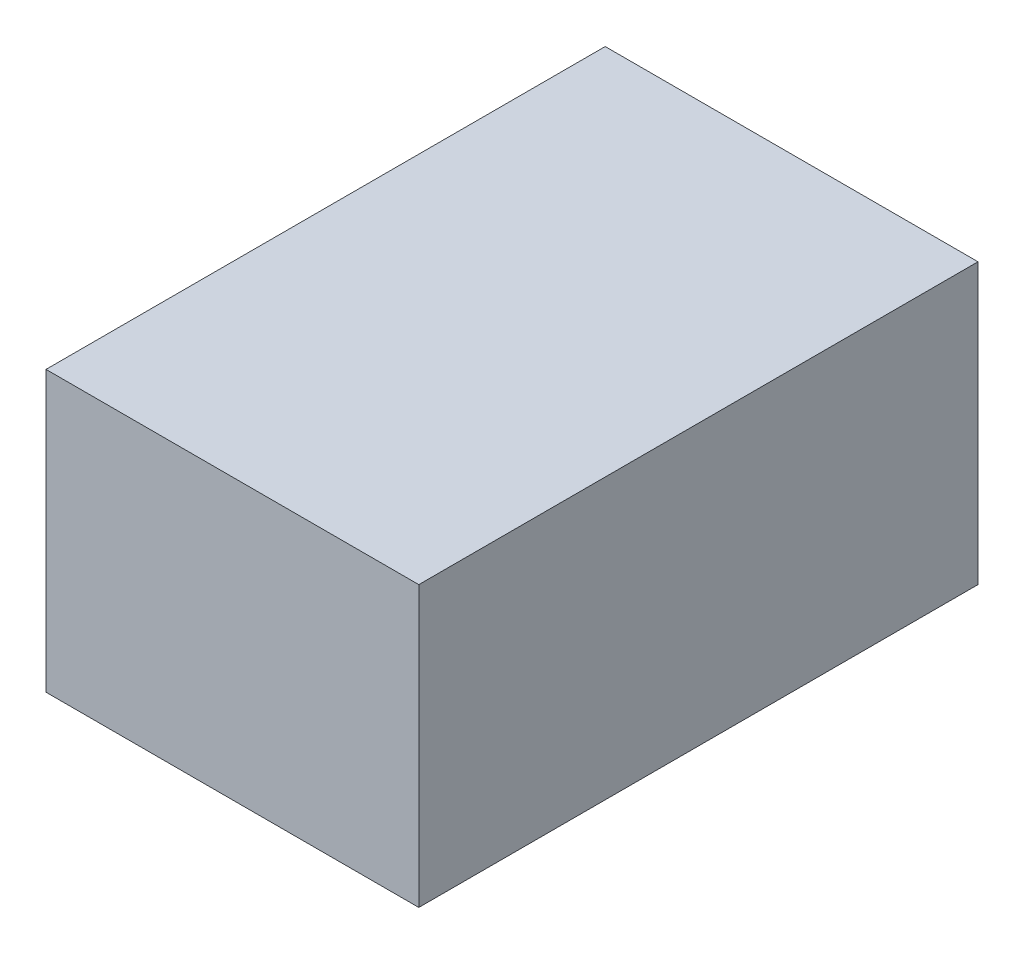
from build123d import *

# Parameters (mm, degrees)
SKETCH1_W           = 609.6
SKETCH1_H           = 914.4
BOSS_EXTRUDE1_DEPTH = 457.2


with BuildPart() as part:
    # Sketch1 → Boss-Extrude1 (new body)
    with BuildSketch(Plane(origin=(0, 0, 0), x_dir=(1, 0, 0), z_dir=(0, 1, 0))):
        with Locations((304.8, 457.2)):
            Rectangle(SKETCH1_W, SKETCH1_H)
    extrude(amount=BOSS_EXTRUDE1_DEPTH)


solid = part.part
